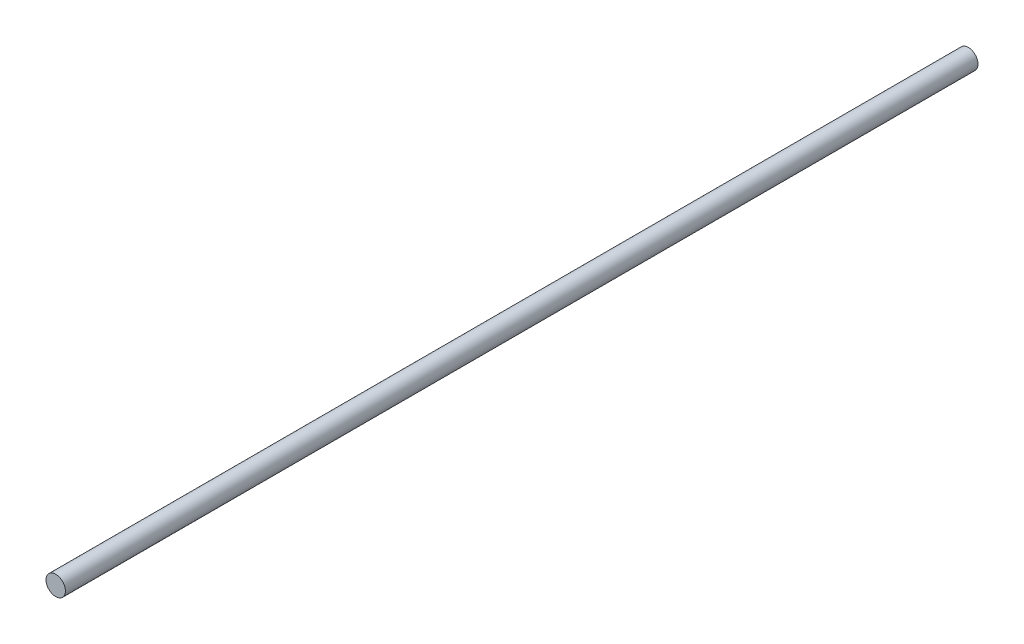
from build123d import *

# Parameters (mm, degrees)
SKETCH2_W = 375.703193978
SKETCH2_H = 4


with BuildPart() as part:
    # Sketch2 → Revolve1 (revolve)
    with BuildSketch(Plane(origin=(0, 0, 0), x_dir=(0, 0, -1), z_dir=(1, 0, 0)), mode=Mode.PRIVATE) as revolve1_sk:
        with Locations((200, 2)):
            Rectangle(SKETCH2_W, SKETCH2_H)
    revolve(revolve1_sk.sketch.rotate(Axis((0, 0, -12.148403011), (0, 0, 1)), 90), axis=Axis((0, 0, -12.148403011), (0, 0, 1)))


solid = part.part
